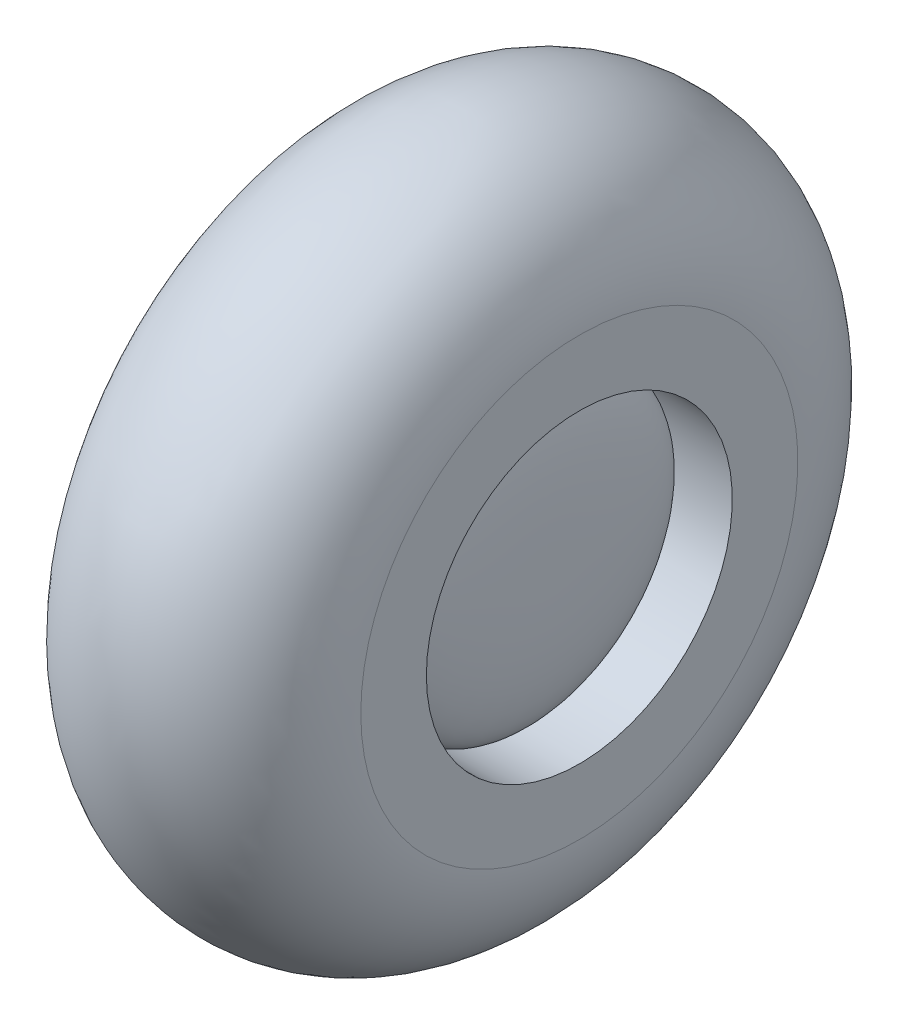
from build123d import *


with BuildPart() as part:
    # Sketch3 → Revolve1 (revolve)
    with BuildSketch(Plane.XY, mode=Mode.PRIVATE) as revolve1_sk:
        with BuildLine():
            Line((-66.675, 0), (66.675, 0))
            add(Edge.make_bspline(
                [(44.45, 104.4575), (66.90298373, 104.4575), (66.675, 43.682715928), (66.675, 0)],
                knots=[0, 0, 0, 0, 1, 1, 1, 1], degree=3))
            Line((44.45, 104.4575), (88.9, 104.4575))
            Line((88.9, 104.4575), (88.9, 149.225))
            ThreePointArc((88.9, 149.225), (0, 238.125), (-88.9, 149.225))
            Line((-88.9, 149.225), (-88.9, 104.4575))
            Line((-88.9, 104.4575), (-44.45, 104.4575))
            add(Edge.make_bspline(
                [(-44.45, 104.4575), (-66.90298373, 104.4575), (-66.675, 43.682715928), (-66.675, 0)],
                knots=[0, 0, 0, 0, 1, 1, 1, 1], degree=3))
        make_face()
    revolve(revolve1_sk.sketch.rotate(Axis((0, 0, 0), (1, 0, 0)), 90), axis=Axis((0, 0, 0), (1, 0, 0)))


solid = part.part
